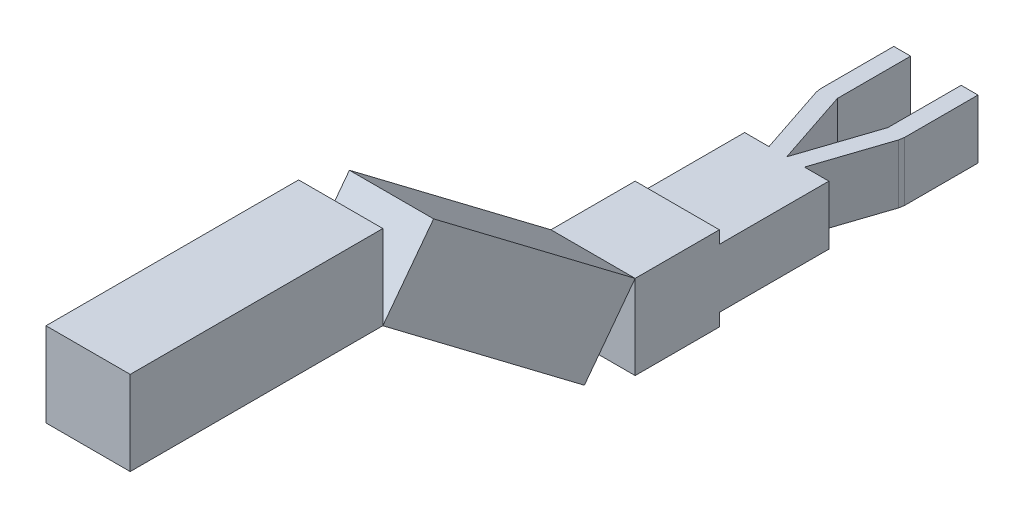
from build123d import *

# Parameters (mm, degrees)
BOSS_EXTRUDE1_DEPTH = 70
SKETCH2_W           = 100
SKETCH2_H           = 100
BOSS_EXTRUDE2_DEPTH = 100
BOSS_EXTRUDE3_DEPTH = 100
SKETCH4_W           = 300
SKETCH4_H           = 100
BOSS_EXTRUDE4_DEPTH = 100


with BuildPart() as part:
    # Sketch1 → Boss-Extrude1 (new body)
    with BuildSketch(Plane(origin=(0, 0, 0), x_dir=(1, 0, 0), z_dir=(0, 1, 0))):
        Polygon((0, -105.768782521), (-30, -15.630000635), (-30, 71.369999365), (-50, 71.369999365), (-50, -15.630000635), (-48.97658566, -21.945790108), (-21.078607457, -105.768782521), (-50, -105.768782521), (-50, -235.768782521), (50, -235.768782521), (50, -105.768782521), (21.078607457, -105.768782521), (48.97658566, -21.945790108), (50, -15.630000635), (50, 71.369999365), (30, 71.369999365), (30, -15.630000635), align=None)
    extrude(amount=BOSS_EXTRUDE1_DEPTH)

    # Sketch2 → Boss-Extrude2 (add)
    with BuildSketch(Plane.XY.offset(235.768782521)):
        with Locations((0, 35)):
            Rectangle(SKETCH2_W, SKETCH2_H)
    extrude(amount=BOSS_EXTRUDE2_DEPTH)


with BuildPart() as body_2:
    # Sketch3 → Boss-Extrude3 (new body)
    with BuildSketch(Plane.ZY.offset(50)):
        Polygon((335.768782521, 85), (396.06206918, 5.220807325), (635.399647205, 186.100667301), (575.106360546, 265.879859976), align=None)
    extrude(amount=-BOSS_EXTRUDE3_DEPTH)


with BuildPart() as body_3:
    # Sketch4 → Boss-Extrude4 (new body)
    with BuildSketch(Plane.ZY.offset(50)):
        with Locations((785.399647205, 236.100667301)):
            Rectangle(SKETCH4_W, SKETCH4_H)
    extrude(amount=-BOSS_EXTRUDE4_DEPTH)


solid = Compound([part.part, body_2.part, body_3.part])
